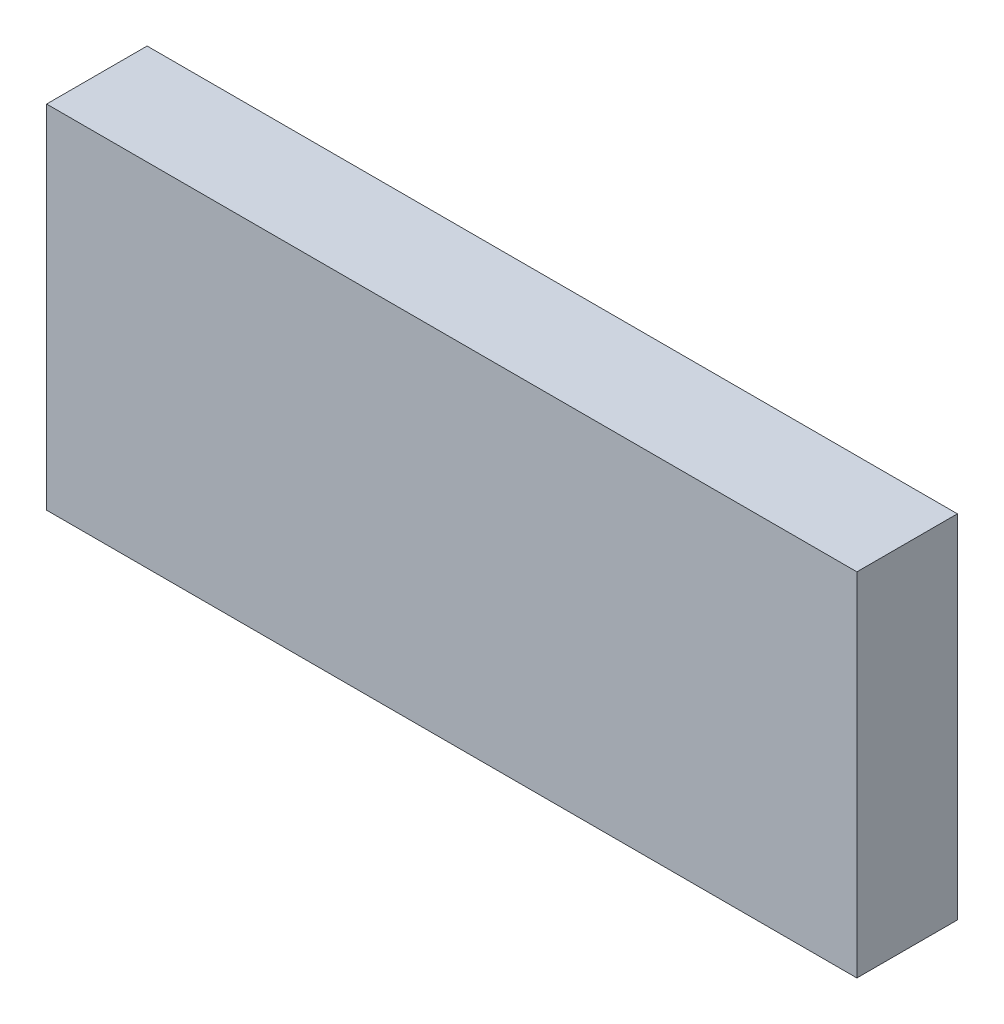
from build123d import *

# Parameters (mm, degrees)
SKETCH1_W           = 819.15
SKETCH1_H           = 355.6
BOSS_EXTRUDE1_DEPTH = 101.6


with BuildPart() as part:
    # Sketch1 → Boss-Extrude1 (new body)
    with BuildSketch(Plane.XY):
        Rectangle(SKETCH1_W, SKETCH1_H)
    extrude(amount=BOSS_EXTRUDE1_DEPTH)


solid = part.part
